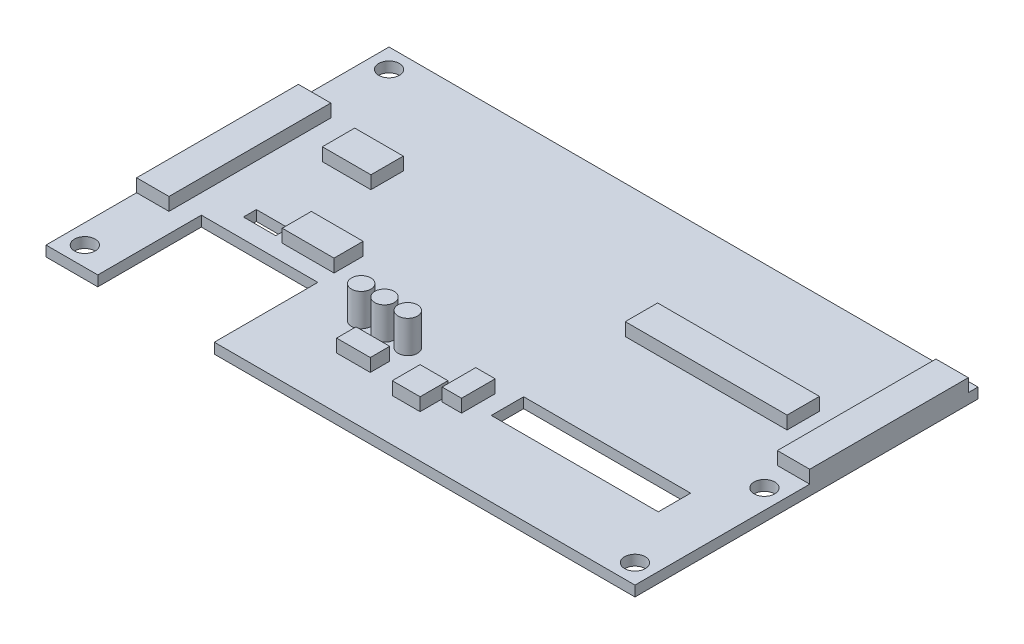
from build123d import *

# Parameters (mm, degrees)
SKETCH_2_R      = 1.6
SKETCH_2_W      = 5
SKETCH_2_H      = 2
SKETCH_2_W_2    = 25.8
SKETCH_2_H_2    = 5
EXTRUDE_1_DEPTH = 1.6
SKETCH_3_W      = 5
SKETCH_3_H      = 25
SKETCH_3_W_2    = 7.5
SKETCH_3_H_2    = 5
SKETCH_3_W_3    = 8
SKETCH_3_H_3    = 4.5
SKETCH_3_W_4    = 25
SKETCH_3_H_4    = 24.5
EXTRUDE_2_DEPTH = 2
SKETCH_4_R      = 1.5
EXTRUDE_3_DEPTH = 5
SKETCH_5_W      = 5.2
SKETCH_5_H      = 3
SKETCH_5_W_2    = 4.3
SKETCH_5_H_2    = 4.3
SKETCH_5_W_3    = 3
SKETCH_5_H_3    = 5.2
EXTRUDE_4_DEPTH = 2


with BuildPart() as part:
    # 草图2 → 凸台-拉伸1 (new body)
    with BuildSketch(Plane(origin=(0, 0, 0), x_dir=(1, 0, 0), z_dir=(0, 1, 0))):
        Polygon((0, 0), (0, -53), (8, -53), (8, -37), (26, -37), (26, -53), (91, -53), (91, 0), align=None)
        with Locations(Location((3, -50, 0), (0, 0, 270))):
            Circle(SKETCH_2_R, mode=Mode.SUBTRACT)
        with Locations(Location((3, -3, 0), (0, 0, 270))):
            Circle(SKETCH_2_R, mode=Mode.SUBTRACT)
        with Locations(Location((88, -30, 0), (0, 0, 270))):
            Circle(SKETCH_2_R, mode=Mode.SUBTRACT)
        with Locations(Location((88, -50, 0), (0, 0, 270))):
            Circle(SKETCH_2_R, mode=Mode.SUBTRACT)
        with Locations((14, -33)):
            Rectangle(SKETCH_2_W, SKETCH_2_H, mode=Mode.SUBTRACT)
        with Locations((70.1, -38.9)):
            Rectangle(SKETCH_2_W_2, SKETCH_2_H_2, mode=Mode.SUBTRACT)
    extrude(amount=EXTRUDE_1_DEPTH)

    # 草图3 → 凸台-拉伸2 (add)
    with BuildSketch(Plane(origin=(0, 1.6, 0), x_dir=(1, 0, 0), z_dir=(0, 1, 0))):
        with Locations((2.5, -26.5)):
            Rectangle(SKETCH_3_W, SKETCH_3_H)
        with Locations((13.95, -18)):
            Rectangle(SKETCH_3_W_2, SKETCH_3_H_2)
        with Locations((22, -32.25)):
            Rectangle(SKETCH_3_W_3, SKETCH_3_H_3)
        with Locations((69.5, -18)):
            Rectangle(SKETCH_3_W_4, SKETCH_3_H_2)
        with Locations((88.5, -13.75)):
            Rectangle(SKETCH_3_W, SKETCH_3_H_4)
    extrude(amount=EXTRUDE_2_DEPTH)

    # 草图4 → 凸台-拉伸3 (add)
    with BuildSketch(Plane(origin=(0, 1.6, 0), x_dir=(1, 0, 0), z_dir=(0, 1, 0))):
        with Locations(Location((34.5, -38.8, 0), (0, 0, 270))):
            Circle(SKETCH_4_R)
        with Locations(Location((38.1, -38.8, 0), (0, 0, 270))):
            Circle(SKETCH_4_R)
        with Locations(Location((41.7, -38.8, 0), (0, 0, 270))):
            Circle(SKETCH_4_R)
    extrude(amount=EXTRUDE_3_DEPTH)

    # 草图5 → 凸台-拉伸4 (add)
    with BuildSketch(Plane(origin=(0, 1.6, 0), x_dir=(1, 0, 0), z_dir=(0, 1, 0))):
        with Locations((39.5, -43.5)):
            Rectangle(SKETCH_5_W, SKETCH_5_H)
        with Locations((49.05, -44.25)):
            Rectangle(SKETCH_5_W_2, SKETCH_5_H_2)
        with Locations((53.1, -40.8)):
            Rectangle(SKETCH_5_W_3, SKETCH_5_H_3)
    extrude(amount=EXTRUDE_4_DEPTH)


solid = part.part
